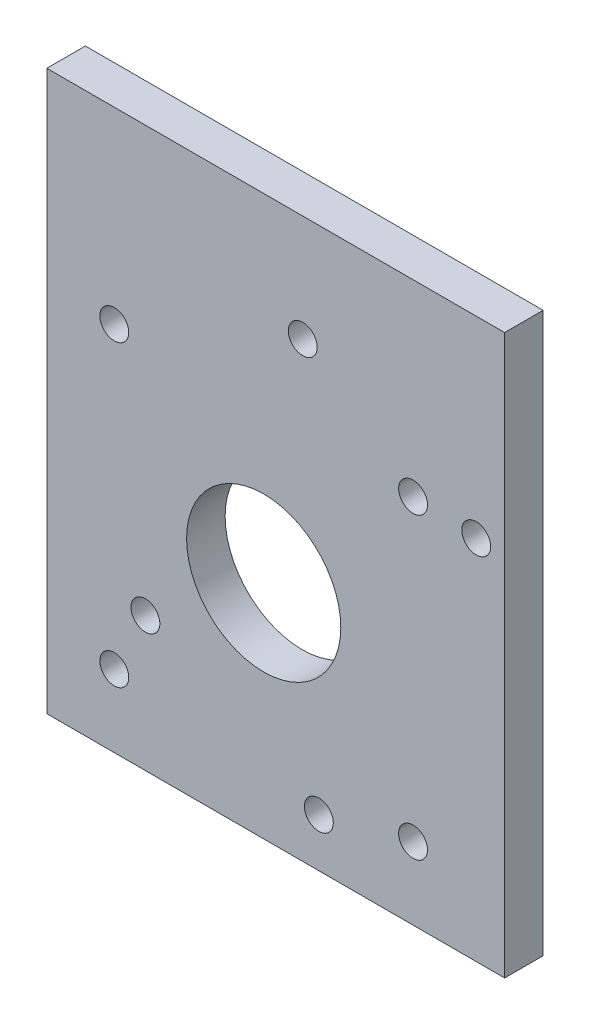
from build123d import *

# Parameters (mm, degrees)
SKETCH1_W           = 42.5
SKETCH1_H           = 40
BOSS_EXTRUDE1_DEPTH = 2
SKETCH2_R           = 1.5
CUT_EXTRUDE1_DEPTH  = 4
SKETCH3_R           = 8
CUT_EXTRUDE2_DEPTH  = 4
SKETCH4_W           = 42.5
SKETCH4_H           = 4
BOSS_EXTRUDE2_DEPTH = 15
SKETCH8_W           = 4
SKETCH8_H           = 55
BOSS_EXTRUDE3_DEPTH = 5
SKETCH7_R           = 1.5
CUT_EXTRUDE3_DEPTH  = 10
SKETCH9_W           = 47.5
SKETCH9_H           = 4
BOSS_EXTRUDE4_DEPTH = 3


with BuildPart() as part:
    # Sketch1 → Boss-Extrude1 (new, symmetric)
    with BuildSketch(Plane.XY):
        Rectangle(SKETCH1_W, SKETCH1_H)
    extrude(amount=BOSS_EXTRUDE1_DEPTH, both=True)

    # Sketch2 → Cut-Extrude1 (cut)
    with BuildSketch(Plane(origin=(0, 0, -2), x_dir=(-1, 0, 0), z_dir=(0, 0, -1))):
        with Locations((-16.75, 15.5)):
            Circle(SKETCH2_R)
        with Locations((14.25, 15.5)):
            Circle(SKETCH2_R)
        with Locations((14.25, -15.5)):
            Circle(SKETCH2_R)
        with Locations((-16.75, -15.5)):
            Circle(SKETCH2_R)
    extrude(amount=-CUT_EXTRUDE1_DEPTH, mode=Mode.SUBTRACT)

    # Sketch3 → Cut-Extrude2 (cut)
    with BuildSketch(Plane.XY.offset(2)):
        with Locations((1.25, 0)):
            Circle(SKETCH3_R)
    extrude(amount=-CUT_EXTRUDE2_DEPTH, mode=Mode.SUBTRACT)

    # Sketch4 → Boss-Extrude2 (add)
    with BuildSketch(Plane(origin=(0, 20, 0), x_dir=(1, 0, 0), z_dir=(0, 1, 0))):
        Rectangle(SKETCH4_W, SKETCH4_H)
    extrude(amount=BOSS_EXTRUDE2_DEPTH)

    # Sketch8 → Boss-Extrude3 (add)
    with BuildSketch(Plane(origin=(21.25, 0, 0), x_dir=(0, 0, -1), z_dir=(1, 0, 0))):
        with Locations((0, 7.5)):
            Rectangle(SKETCH8_W, SKETCH8_H)
    extrude(amount=BOSS_EXTRUDE3_DEPTH)

    # Sketch7 → Cut-Extrude3 (cut)
    with BuildSketch(Plane.XY.offset(2)):
        with Locations((5.303802982, 23.945501151)):
            Circle(SKETCH7_R)
        with Locations((23.303478189, 15.039308246)):
            Circle(SKETCH7_R)
        with Locations((6.975457864, -17.9600963)):
            Circle(SKETCH7_R)
        with Locations((-11.024217343, -9.053903396)):
            Circle(SKETCH7_R)
    extrude(amount=-CUT_EXTRUDE3_DEPTH, mode=Mode.SUBTRACT)

    # Sketch9 → Boss-Extrude4 (add)
    with BuildSketch(Plane.XZ.offset(20)):
        with Locations((2.5, 0)):
            Rectangle(SKETCH9_W, SKETCH9_H)
    extrude(amount=BOSS_EXTRUDE4_DEPTH)


solid = part.part
